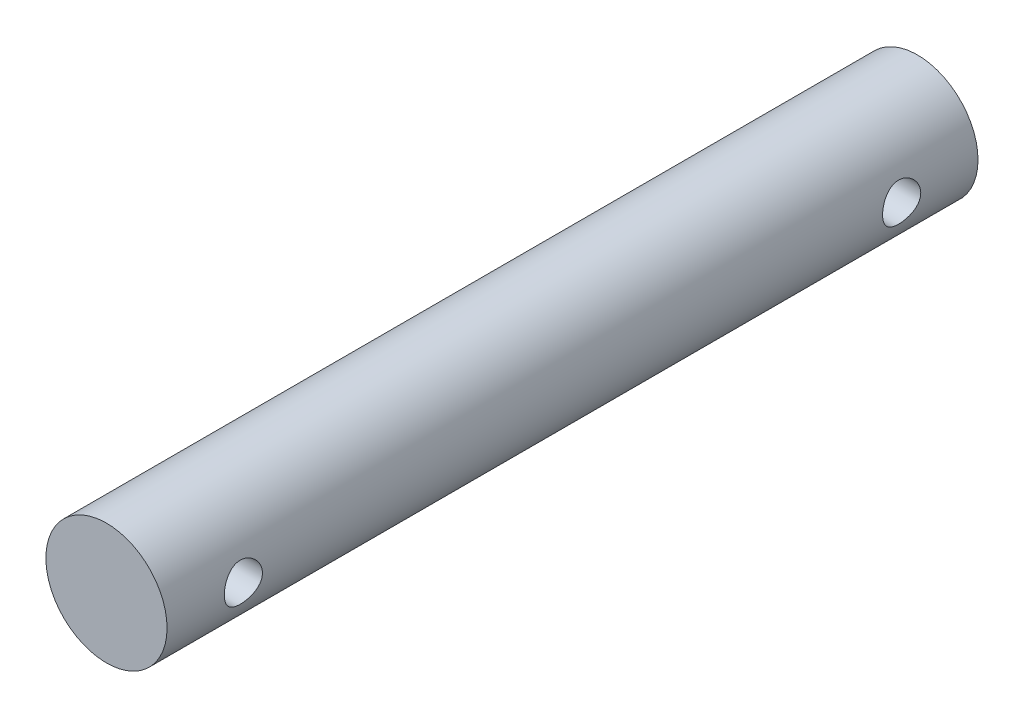
from build123d import *

# Parameters (mm, degrees)
CROQUIS1_R                 = 6.35
SALIENTE_EXTRUIR1_DEPTH    = 85
CORTAR_EXTRUIR1_DEPTH      = 86.473065933
CORTAR_EXTRUIR1_DEPTH_BACK = 86.473065933
CROQUIS2_R                 = 2


with BuildPart() as part:
    # Croquis1 → Saliente-Extruir1 (new body)
    with BuildSketch(Plane.XY):
        Circle(CROQUIS1_R)
    extrude(amount=SALIENTE_EXTRUIR1_DEPTH)

    # Croquis2 → Cortar-Extruir1 (cut, two sides: drawn at the far end of the back side and taken through both)
    with BuildSketch(Plane(origin=(0, 0, 0), x_dir=(0, 0, -1), z_dir=(1, 0, 0)).offset(-CORTAR_EXTRUIR1_DEPTH_BACK)):
        with Locations(Location((-8, 0, 0), (0, 0, 179.999999999))):
            Circle(CROQUIS2_R)
        with Locations(Location((-77, 0, 0), (0, 0, 179.999999999))):
            Circle(CROQUIS2_R)
    extrude(amount=CORTAR_EXTRUIR1_DEPTH + CORTAR_EXTRUIR1_DEPTH_BACK, mode=Mode.SUBTRACT)


solid = part.part
